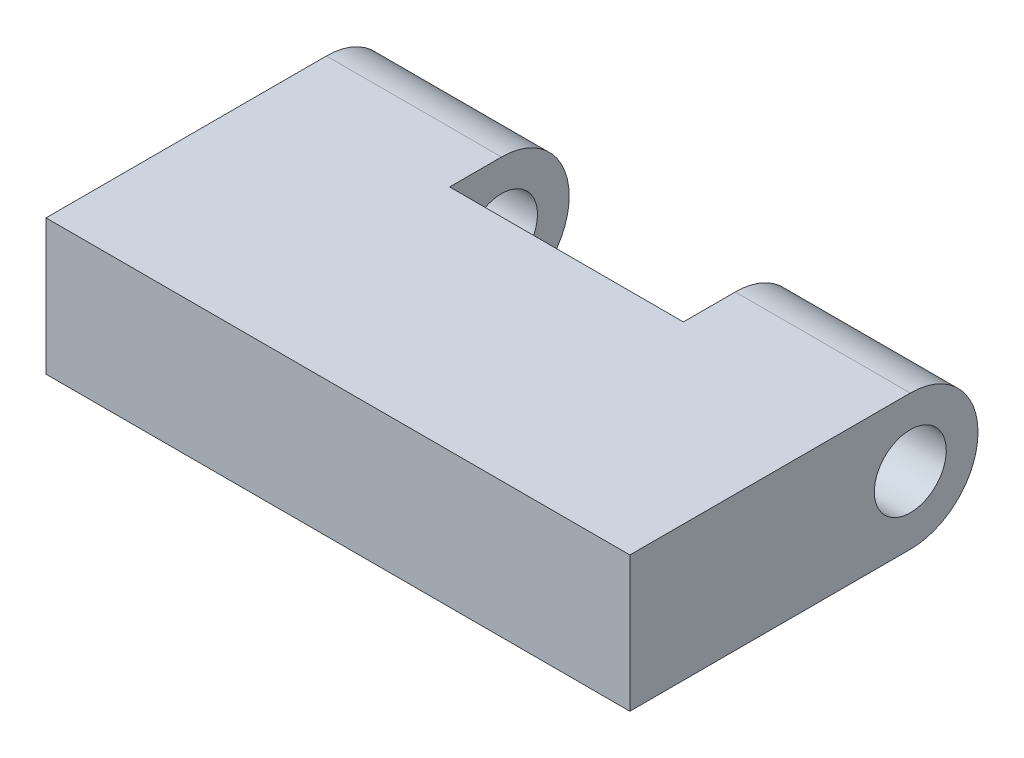
from build123d import *

# Parameters (mm, degrees)
SKETCH2_R           = 2.055531292
BOSS_EXTRUDE1_DEPTH = 10
SKETCH3_W           = 13.058934706
SKETCH3_H           = 7.734398283
BOSS_EXTRUDE2_DEPTH = 13.356191657


with BuildPart() as part:
    # Sketch2 → Boss-Extrude1 (new body)
    with BuildSketch(Plane(origin=(6.678095828, 0, 0), x_dir=(0, 0, -1), z_dir=(1, 0, 0))):
        with BuildLine():
            Line((2.069151562, 21.444166214), (-3.368651258, 21.444166214))
            Line((-3.368651258, 21.444166214), (-13.95384316, 21.444166214))
            Line((-13.95384316, 21.444166214), (-13.95384316, 13.709767931))
            Line((-13.95384316, 13.709767931), (-3.368651258, 13.709767931))
            Line((-3.368651258, 13.709767931), (2.069151562, 13.709767931))
            ThreePointArc((2.069151562, 13.709767931), (5.936350704, 17.576967072), (2.069151562, 21.444166214))
        make_face()
        with Locations(Location((2.069151562, 17.576967072, 0), (0, 0, 90))):
            Circle(SKETCH2_R, mode=Mode.SUBTRACT)
    extrude(amount=BOSS_EXTRUDE1_DEPTH)


with BuildPart() as body_2:
    # Mirror2: mirrored copy
    add(part.part.mirror(Plane(origin=(0, 0, 0), x_dir=(0, 0, 1), z_dir=(1, 0, 0))))


with BuildPart() as part_1:
    add(part.part)

    add(body_2.part)  # Boss-Extrude2 merges body 2
    # Sketch3 → Boss-Extrude2 (add)
    with BuildSketch(Plane.ZY.offset(-6.678095828)):
        with Locations((7.424375807, 17.576967073)):
            Rectangle(SKETCH3_W, SKETCH3_H)
    extrude(amount=BOSS_EXTRUDE2_DEPTH)


solid = part_1.part
